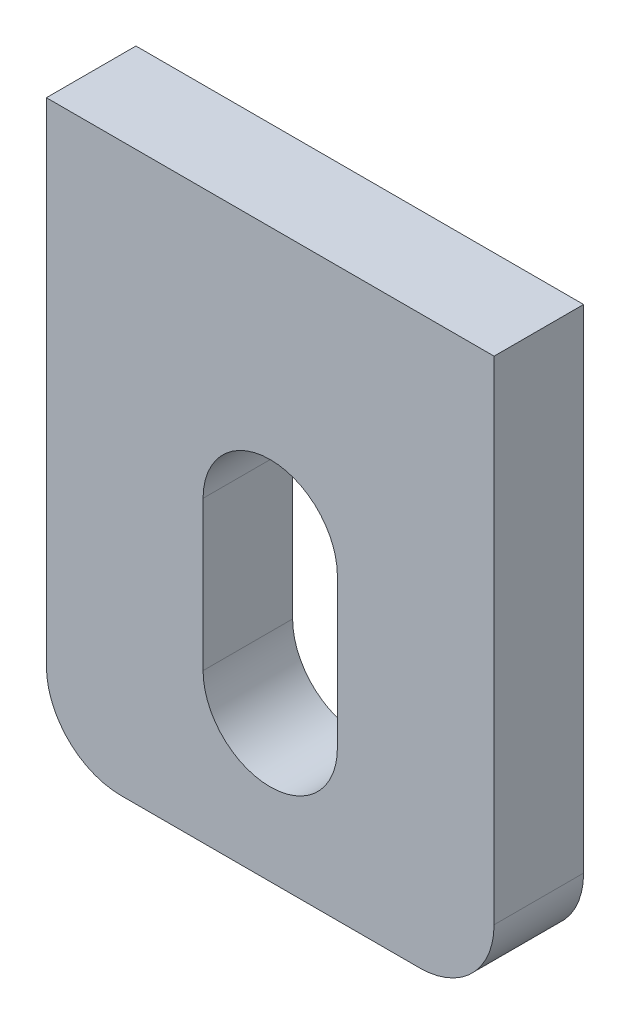
from build123d import *

# Parameters (mm, degrees)
SKETCH_1_W      = 30
SKETCH_1_H      = 38
EXTRUDE_1_DEPTH = 6
FILLET_1_R      = 5


with BuildPart() as part:
    # 草图1 → 凸台-拉伸1 (new body)
    with BuildSketch(Plane.XY):
        with Locations((15, 19)):
            Rectangle(SKETCH_1_W, SKETCH_1_H)
        with BuildLine():
            Line((19.5, 20), (19.5, 10))
            ThreePointArc((19.5, 10), (15, 5.5), (10.5, 10))
            Line((10.5, 10), (10.5, 20))
            ThreePointArc((10.5, 20), (15, 24.5), (19.5, 20))
        make_face(mode=Mode.SUBTRACT)
    extrude(amount=EXTRUDE_1_DEPTH)

    # 圆角1
    fillet_1_edges = [part.edges().sort_by_distance(p)[0] for p in [
        (30, 0, 3),
        (0, 0, 3),
    ]]
    fillet(fillet_1_edges, radius=FILLET_1_R)


solid = part.part
